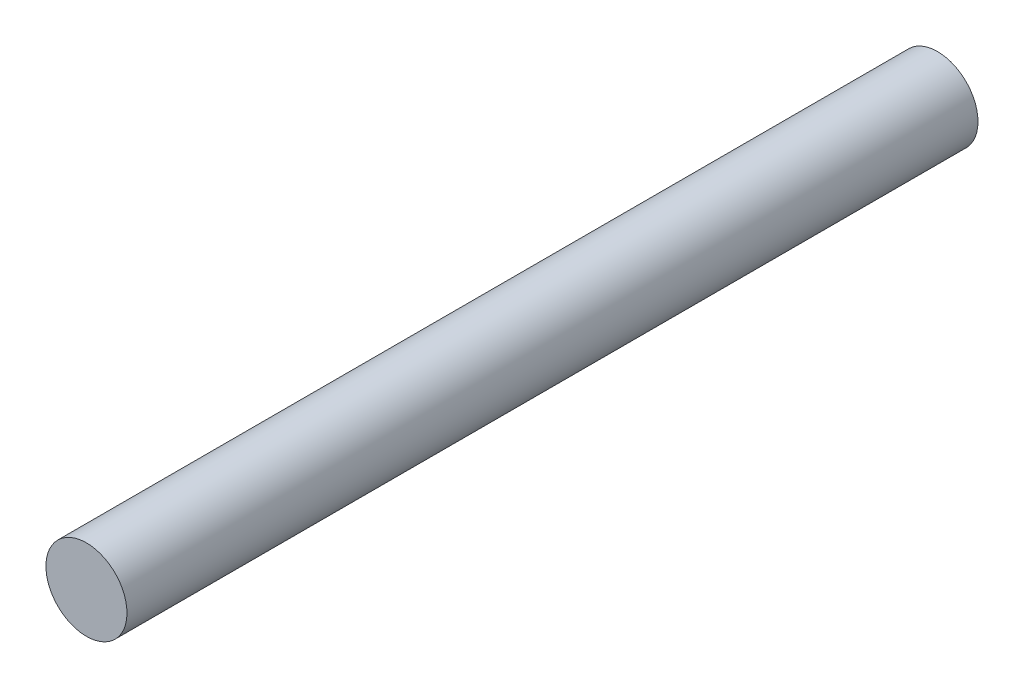
from build123d import *

# Parameters (mm, degrees)
SKETCH_1_R      = 10
EXTRUDE_1_DEPTH = 210


with BuildPart() as part:
    # Эскиз1 → Бобышка-Вытянуть1 (new body)
    with BuildSketch(Plane.XY):
        Circle(SKETCH_1_R)
    extrude(amount=EXTRUDE_1_DEPTH)


solid = part.part
